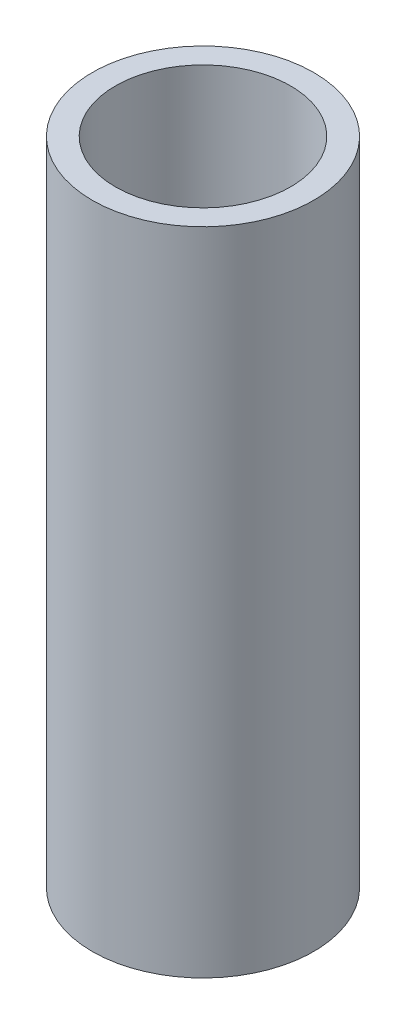
from build123d import *

# Parameters (mm, degrees)
SKETCH1_R           = 1.702
SKETCH1_R_2         = 1.346
BOSS_EXTRUDE1_DEPTH = 10


with BuildPart() as part:
    # Sketch1 → Boss-Extrude1 (new body)
    with BuildSketch(Plane(origin=(0, 0, 0), x_dir=(1, 0, 0), z_dir=(0, 1, 0))):
        with Locations(Location((0, 0, 0), (0, 0, 270))):
            Circle(SKETCH1_R)
        with Locations(Location((0, 0, 0), (0, 0, 270))):
            Circle(SKETCH1_R_2, mode=Mode.SUBTRACT)
    extrude(amount=BOSS_EXTRUDE1_DEPTH)


solid = part.part
